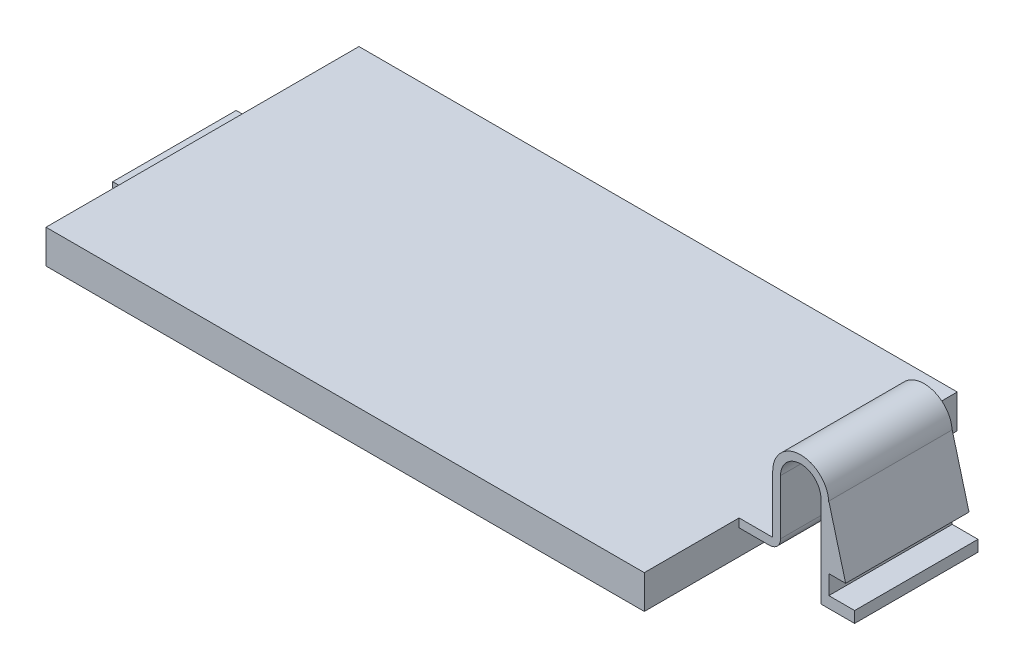
from build123d import *

# Parameters (mm, degrees)
BOSS_EXTRUDE1_DEPTH = 5.5
SKETCH2_W           = 53.34
SKETCH2_H           = 3
BOSS_EXTRUDE2_DEPTH = 13.95
SCALE1_SCALE        = 0.98


with BuildPart() as part:
    # Sketch1 → Boss-Extrude1 (new, symmetric)
    with BuildSketch(Plane.XY):
        with BuildLine():
            Line((0, 0), (2.5, 0))
            Line((2.5, 0), (2.5, -0.54))
            Line((2.5, -0.54), (55.84, -0.54))
            Line((55.84, -0.54), (55.84, 1.698))
            Line((55.84, 1.698), (57.84, 1.698))
            Line((57.84, 1.698), (58.54, 1.698))
            ThreePointArc((58.54, 1.698), (59.247106781, 1.990893219), (59.54, 2.698))
            Line((59.54, 2.698), (59.54, 7.579046555))
            ThreePointArc((59.54, 7.579046555), (61.34, 9.379046555), (63.14, 7.579046555))
            Line((63.14, 7.579046555), (63.14, -0.54))
            Line((63.14, -0.54), (66.14, -0.54))
            Line((66.14, -0.54), (66.14, 0.46))
            Line((66.14, 0.46), (63.84, 0.46))
            Line((63.84, 0.46), (63.84, 2.16))
            Line((63.84, 2.16), (65.34, 2.16))
            Line((65.34, 2.16), (63.84, 7.758076211))
            Line((63.84, 7.758076211), (63.84, 7.579046555))
            ThreePointArc((63.84, 7.579046555), (61.34, 10.079046555), (58.84, 7.579046555))
            Line((58.84, 7.579046555), (58.84, 2.46))
            Line((58.84, 2.46), (55.84, 2.46))
            Line((55.84, 2.46), (2.5, 2.46))
            Line((2.5, 2.46), (2.5, 0.5))
            Line((2.5, 0.5), (0, 0.5))
            Line((0, 0.5), (0, 0))
        make_face()
    extrude(amount=BOSS_EXTRUDE1_DEPTH, both=True)

    # Sketch2 → Boss-Extrude2 (add, symmetric)
    with BuildSketch(Plane.XY):
        with Locations((29.17, 0.96)):
            Rectangle(SKETCH2_W, SKETCH2_H)
    extrude(amount=BOSS_EXTRUDE2_DEPTH, both=True)


with BuildPart() as part_1:
    # Scale1: scaled about (30.852442752, 1.144909894, 0)
    add(part.part.scale(SCALE1_SCALE).moved(Location((0.617048855, 0.022898198, 0))))


solid = part_1.part
